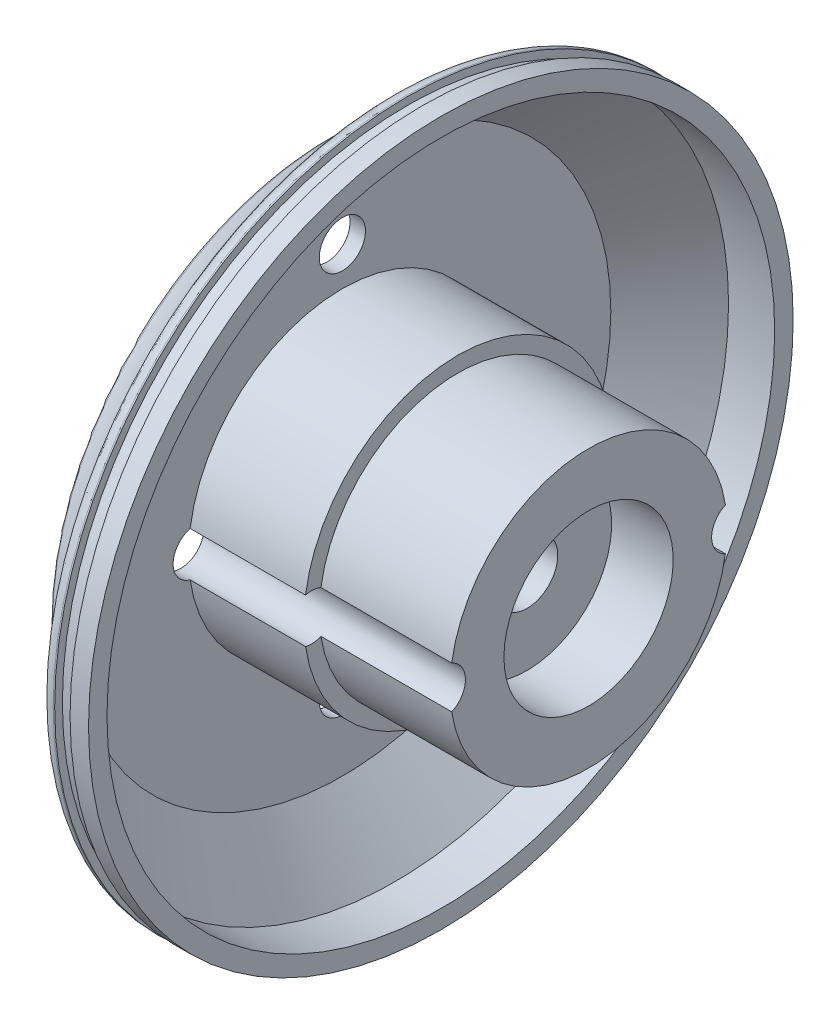
from build123d import *

# Parameters (mm, degrees)
FILLET1_R          = 1
SKETCH3_R          = 1.5
CUT_EXTRUDE2_DEPTH = 37.576222301


with BuildPart() as part:
    # Sketch1 → Revolve1 (revolve)
    with BuildSketch(Plane.XY, mode=Mode.PRIVATE) as revolve1_sk:
        with BuildLine():
            Line((4, 2), (4, 5.5))
            Line((4, 5.5), (0, 5.5))
            Line((0, 5.5), (0, 18))
            ThreePointArc((0, 18), (2.598670777, 20.129792144), (4.5, 22.9))
            Line((4.5, 22.9), (5.2, 22.9))
            Line((5.2, 22.9), (5.2, 22.4))
            Line((5.2, 22.4), (6.2, 22.4))
            Line((6.2, 22.4), (6.2, 22.9))
            Line((6.2, 22.9), (7.4, 22.9))
            Line((7.4, 22.9), (7.4, 21.7))
            Line((7.4, 21.7), (4.4, 21.7))
            Line((4.4, 21.7), (1, 17.446887131))
            Line((1, 17.446887131), (1, 10))
            Line((1, 10), (8.5, 10))
            Line((8.5, 10), (8.5, 9))
            Line((8.5, 9), (17, 9))
            Line((17, 9), (17, 5.5))
            Line((17, 5.5), (13, 5.5))
            Line((13, 5.5), (13, 2))
            Line((13, 2), (4, 2))
        make_face()
    revolve(revolve1_sk.sketch.rotate(Axis((0, 0, 0), (1, 0, 0)), 90), axis=Axis((0, 0, 0), (1, 0, 0)))

    # Fillet1
    fillet1_edges = [part.edges().sort_by_distance(p)[0] for p in [
        (4.5, 0, -22.9),
        (0, 0, -18),
    ]]
    fillet(fillet1_edges, radius=FILLET1_R)

    # Sketch3 → Cut-Extrude2 (cut, through all)
    with BuildSketch(Plane.ZY):
        with Locations(Location((-9.5, 0, 0), (0, 0, 270))):
            Circle(SKETCH3_R)
        with Locations(Location((0, 12.5, 0), (0, 0, 270))):
            Circle(SKETCH3_R)
        with Locations(Location((9.5, 0, 0), (0, 0, 270))):
            Circle(SKETCH3_R)
        with Locations(Location((0, -12.5, 0), (0, 0, 270))):
            Circle(SKETCH3_R)
    extrude(amount=-CUT_EXTRUDE2_DEPTH, mode=Mode.SUBTRACT)


solid = part.part
